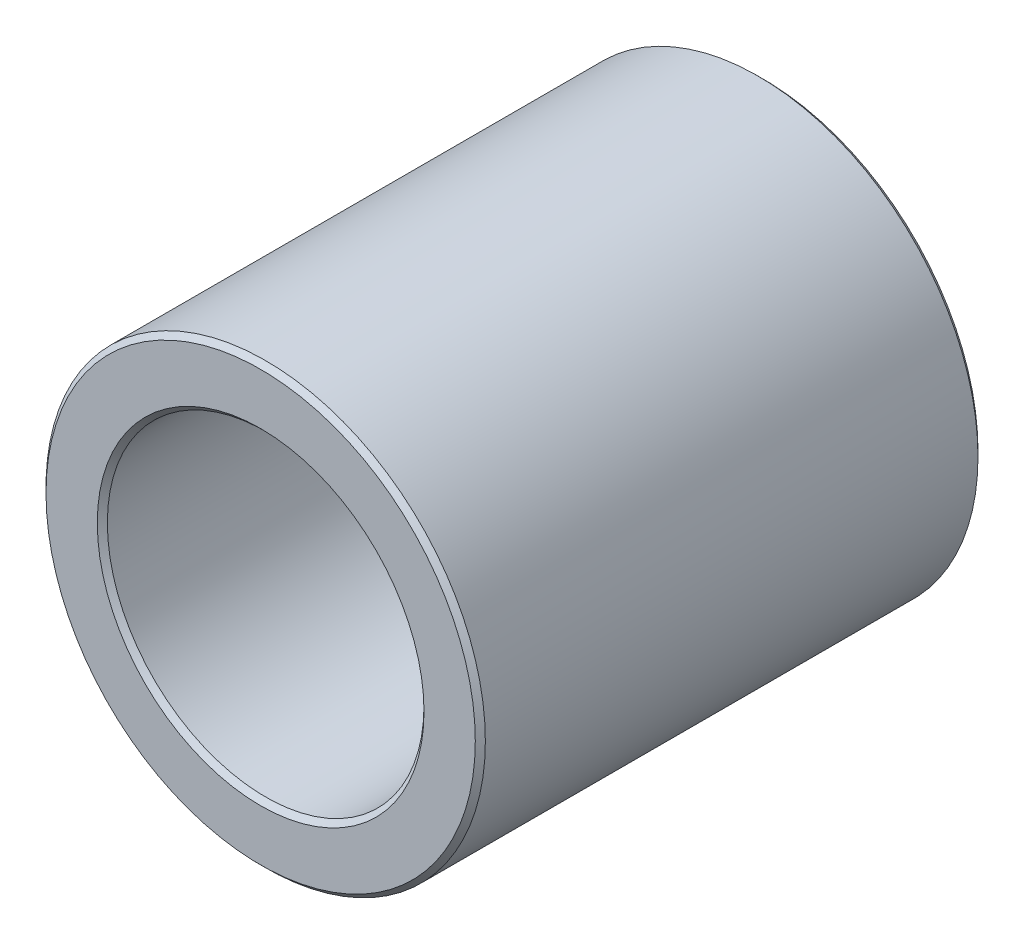
from build123d import *

# Parameters (mm, degrees)
SKETCH1_R           = 5.5499
SKETCH1_R_2         = 4.000000001
BOSS_EXTRUDE1_DEPTH = 12.7
CHAMFER1_SIZE       = 0.127


with BuildPart() as part:
    # Sketch1 → Boss-Extrude1 (new body)
    with BuildSketch(Plane.XY):
        Circle(SKETCH1_R)
        Circle(SKETCH1_R_2, mode=Mode.SUBTRACT)
    extrude(amount=BOSS_EXTRUDE1_DEPTH)

    # Chamfer1
    chamfer1_edges = [part.edges().sort_by_distance(p)[0] for p in [
        (-5.5499, 0, 0),
        (-5.5499, 0, 12.7),
        (-4.000000001, 0, 0),
        (-4.000000001, 0, 12.7),
    ]]
    chamfer(chamfer1_edges, length=CHAMFER1_SIZE)


solid = part.part
